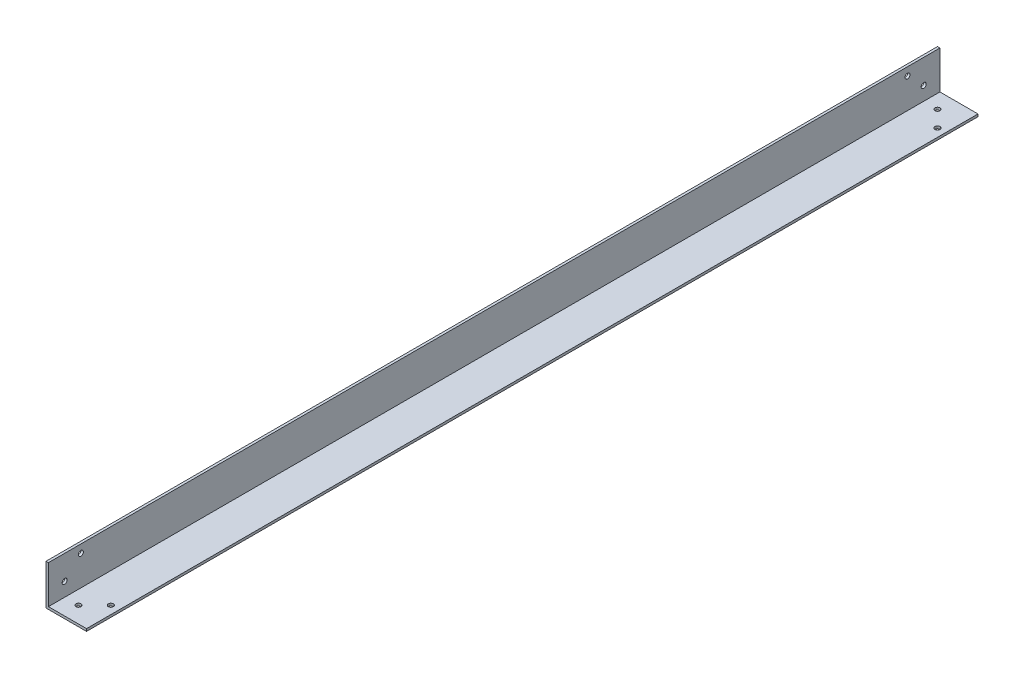
from build123d import *

# Parameters (mm, degrees)
BOSS_EXTRUDE1_DEPTH = 550
SKETCH2_R           = 1.55
CUT_EXTRUDE1_DEPTH  = 10
SKETCH3_R           = 1.55
CUT_EXTRUDE2_DEPTH  = 10


with BuildPart() as part:
    # Sketch1 → Boss-Extrude1 (new body)
    with BuildSketch(Plane.XY):
        Polygon((0, 0), (0, 25), (1.5, 25), (1.5, 1.5), (25, 1.5), (25, 0), align=None)
    extrude(amount=BOSS_EXTRUDE1_DEPTH)

    # Sketch2 → Cut-Extrude1 (cut)
    with BuildSketch(Plane.ZY):
        with Locations((10, 10)):
            Circle(SKETCH2_R)
        with Locations((20, 20)):
            Circle(SKETCH2_R)
        with Locations((530, 20)):
            Circle(SKETCH2_R)
        with Locations((540, 10)):
            Circle(SKETCH2_R)
    extrude(amount=-CUT_EXTRUDE1_DEPTH, mode=Mode.SUBTRACT)

    # Sketch3 → Cut-Extrude2 (cut)
    with BuildSketch(Plane.XZ):
        with Locations((10, 540)):
            Circle(SKETCH3_R)
        with Locations((20, 530)):
            Circle(SKETCH3_R)
        with Locations((20, 20)):
            Circle(SKETCH3_R)
        with Locations((10, 10)):
            Circle(SKETCH3_R)
    extrude(amount=-CUT_EXTRUDE2_DEPTH, mode=Mode.SUBTRACT)


solid = part.part
